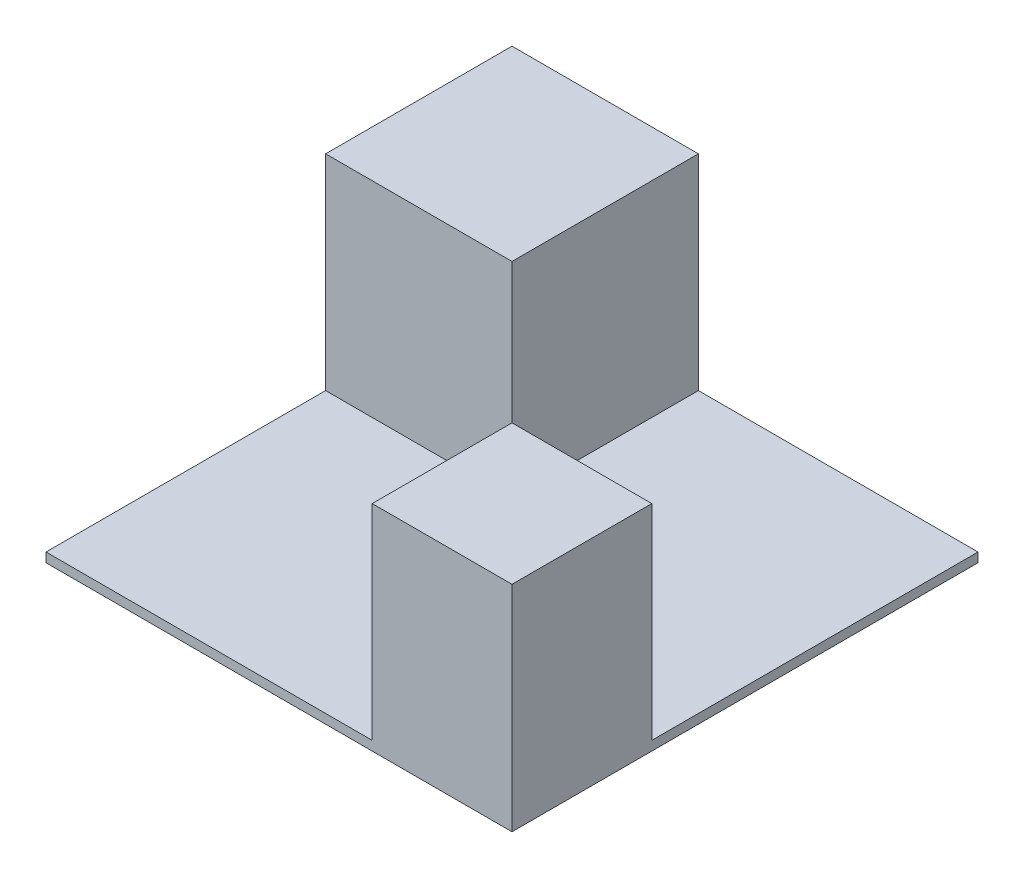
from build123d import *

# Parameters (mm, degrees)
SKETCH1_W           = 50
SKETCH1_H           = 50
BOSS_EXTRUDE1_DEPTH = 1
SKETCH2_W           = 20
SKETCH2_H           = 20
SKETCH2_W_2         = 15
SKETCH2_H_2         = 15
BOSS_EXTRUDE2_DEPTH = 22


with BuildPart() as part:
    # Sketch1 → Boss-Extrude1 (new body)
    with BuildSketch(Plane(origin=(0, 0, 0), x_dir=(1, 0, 0), z_dir=(0, 1, 0))):
        with Locations((25, 25)):
            Rectangle(SKETCH1_W, SKETCH1_H)
    extrude(amount=BOSS_EXTRUDE1_DEPTH)

    # Sketch2 → Boss-Extrude2 (add)
    with BuildSketch(Plane(origin=(0, 1, 0), x_dir=(1, 0, 0), z_dir=(0, 1, 0))):
        with Locations((10, 40)):
            Rectangle(SKETCH2_W, SKETCH2_H)
        with Locations((42.5, 7.5)):
            Rectangle(SKETCH2_W_2, SKETCH2_H_2)
    extrude(amount=BOSS_EXTRUDE2_DEPTH)


solid = part.part
